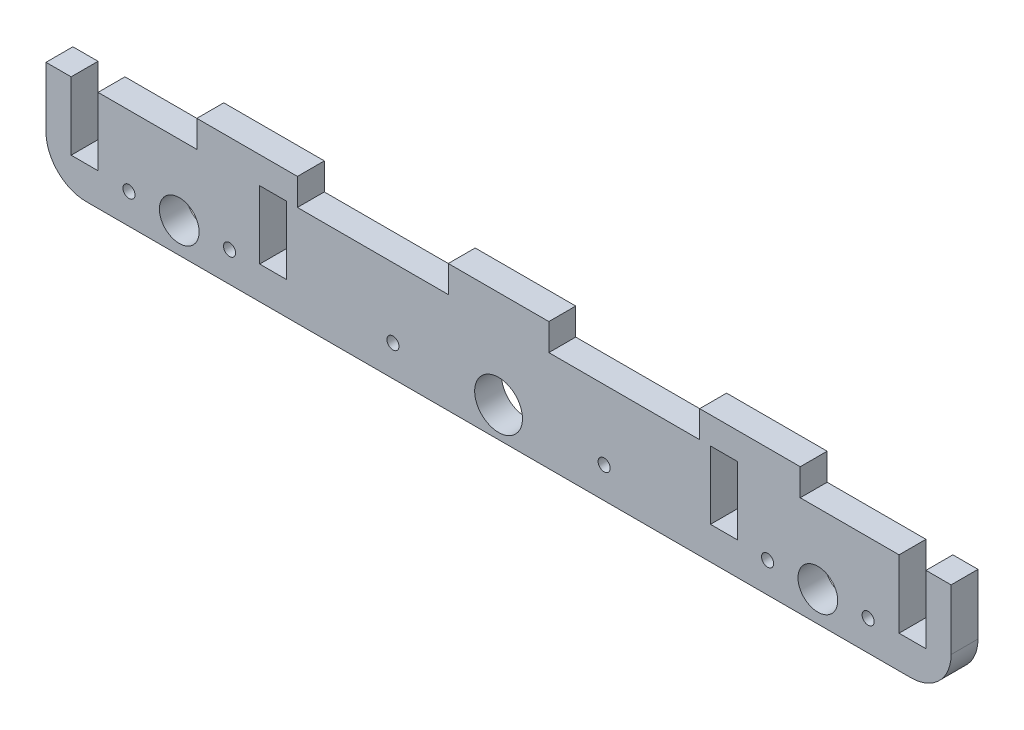
from build123d import *

# Parameters (mm, degrees)
MODEL_R             = 4.75
MODEL_R_2           = 3.95
MODEL_R_3           = 1.2
MODEL_W             = 5.35
MODEL_H             = 13.5
BOSS_EXTRUDE1_DEPTH = 5.35


with BuildPart() as part:
    # Model → Boss-Extrude1 (new body)
    with BuildSketch(Plane.XY):
        with BuildLine():
            Line((-40, 20), (-10, 20))
            Line((-10, 20), (-10, 25.35))
            Line((-10, 25.35), (10, 25.35))
            Line((10, 25.35), (10, 20))
            Line((10, 20), (40, 20))
            Line((40, 20), (40, 25.35))
            Line((40, 25.35), (60, 25.35))
            Line((60, 25.35), (60, 20))
            Line((60, 20), (79.65, 20))
            Line((79.65, 20), (79.65, 6.5))
            Line((79.65, 6.5), (85, 6.5))
            Line((85, 6.5), (85, 20))
            Line((85, 20), (90, 20))
            Line((90, 20), (90, 8))
            ThreePointArc((90, 8), (87.656854249, 2.343145751), (82, 0))
            Line((82, 0), (-82, 0))
            ThreePointArc((-82, 0), (-87.656854249, 2.343145751), (-90, 8))
            Line((-90, 8), (-90, 20))
            Line((-90, 20), (-85, 20))
            Line((-85, 20), (-85, 6.5))
            Line((-85, 6.5), (-79.65, 6.5))
            Line((-79.65, 6.5), (-79.65, 20))
            Line((-79.65, 20), (-60, 20))
            Line((-60, 20), (-60, 25.35))
            Line((-60, 25.35), (-40, 25.35))
            Line((-40, 25.35), (-40, 20))
        make_face()
        with Locations((0, 6)):
            Circle(MODEL_R, mode=Mode.SUBTRACT)
        with Locations((-63.5, 6)):
            Circle(MODEL_R_2, mode=Mode.SUBTRACT)
        with Locations((-53.5, 6)):
            Circle(MODEL_R_3, mode=Mode.SUBTRACT)
        with Locations((-73.5, 6)):
            Circle(MODEL_R_3, mode=Mode.SUBTRACT)
        with Locations((-21, 6.16)):
            Circle(MODEL_R_3, mode=Mode.SUBTRACT)
        with Locations(Location((73.5, 6, 0), (0, 0, 180))):
            Circle(MODEL_R_3, mode=Mode.SUBTRACT)
        with Locations(Location((63.5, 6, 0), (0, 0, 180))):
            Circle(MODEL_R_2, mode=Mode.SUBTRACT)
        with Locations(Location((53.5, 6, 0), (0, 0, 180))):
            Circle(MODEL_R_3, mode=Mode.SUBTRACT)
        with Locations(Location((21, 6.16, 0), (0, 0, 180))):
            Circle(MODEL_R_3, mode=Mode.SUBTRACT)
        with Locations((-44.825, 13.25)):
            Rectangle(MODEL_W, MODEL_H, mode=Mode.SUBTRACT)
        with Locations((44.825, 13.25)):
            Rectangle(MODEL_W, MODEL_H, mode=Mode.SUBTRACT)
    extrude(amount=BOSS_EXTRUDE1_DEPTH)


solid = part.part
